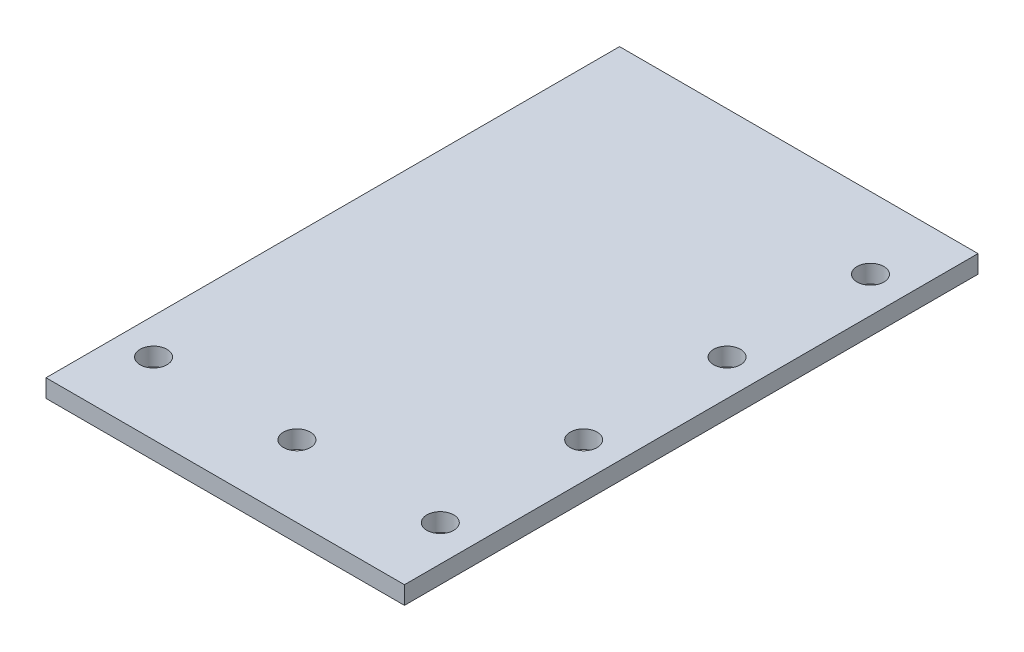
from build123d import *

# Parameters (mm, degrees)
SKETCH1_W           = 63.5
SKETCH1_H           = 101.6
BOSS_EXTRUDE1_DEPTH = 3.175
SKETCH2_R           = 2.38125
CUT_EXTRUDE1_DEPTH  = 3.175


with BuildPart() as part:
    # Sketch1 → Boss-Extrude1 (new body)
    with BuildSketch(Plane(origin=(0, 0, 0), x_dir=(1, 0, 0), z_dir=(0, 1, 0))):
        Rectangle(SKETCH1_W, SKETCH1_H)
    extrude(amount=BOSS_EXTRUDE1_DEPTH)

    # Sketch2 → Cut-Extrude1 (cut)
    with BuildSketch(Plane(origin=(0, 3.175, 0), x_dir=(1, 0, 0), z_dir=(0, 1, 0))):
        with Locations(Location((25.4, -38.1, 0), (0, 0, 270))):
            Circle(SKETCH2_R)
        with Locations(Location((25.4, -12.7, 0), (0, 0, 270))):
            Circle(SKETCH2_R)
        with Locations(Location((25.4, 12.7, 0), (0, 0, 270))):
            Circle(SKETCH2_R)
        with Locations(Location((25.4, 38.1, 0), (0, 0, 270))):
            Circle(SKETCH2_R)
        with Locations(Location((0, -38.1, 0), (0, 0, 270))):
            Circle(SKETCH2_R)
        with Locations(Location((-25.4, -38.1, 0), (0, 0, 270))):
            Circle(SKETCH2_R)
        with Locations((-50.8, -38.1)):
            Circle(SKETCH2_R)
    extrude(amount=-CUT_EXTRUDE1_DEPTH, mode=Mode.SUBTRACT)


solid = part.part
